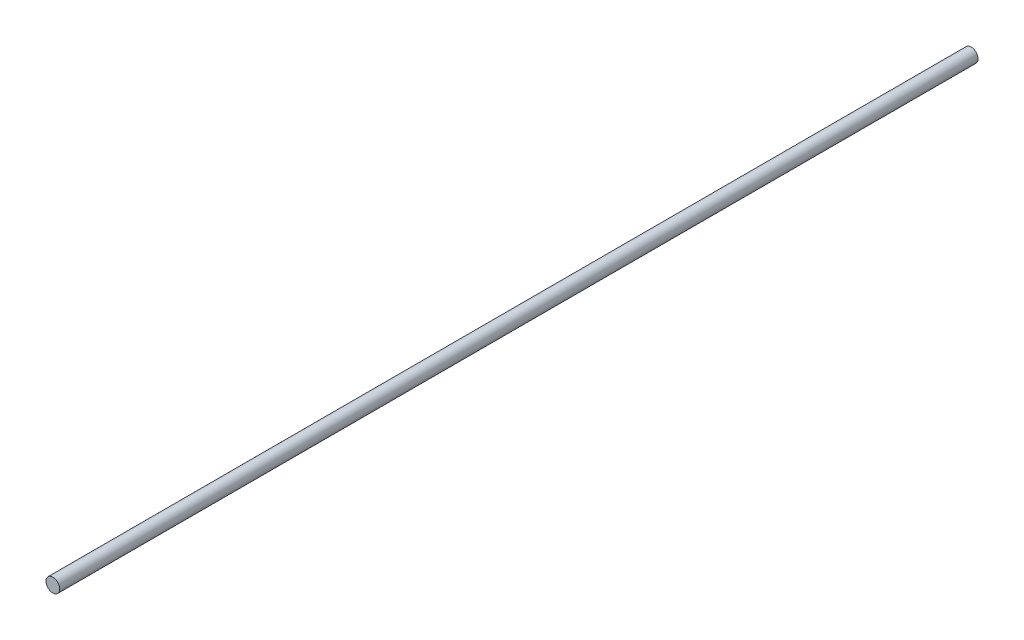
from build123d import *

# Parameters (mm, degrees)
SKETCH1_R           = 4
BOSS_EXTRUDE1_DEPTH = 267.75


with BuildPart() as part:
    # Sketch1 → Boss-Extrude1 (new, symmetric)
    with BuildSketch(Plane.XY):
        Circle(SKETCH1_R)
    extrude(amount=BOSS_EXTRUDE1_DEPTH, both=True)


solid = part.part
